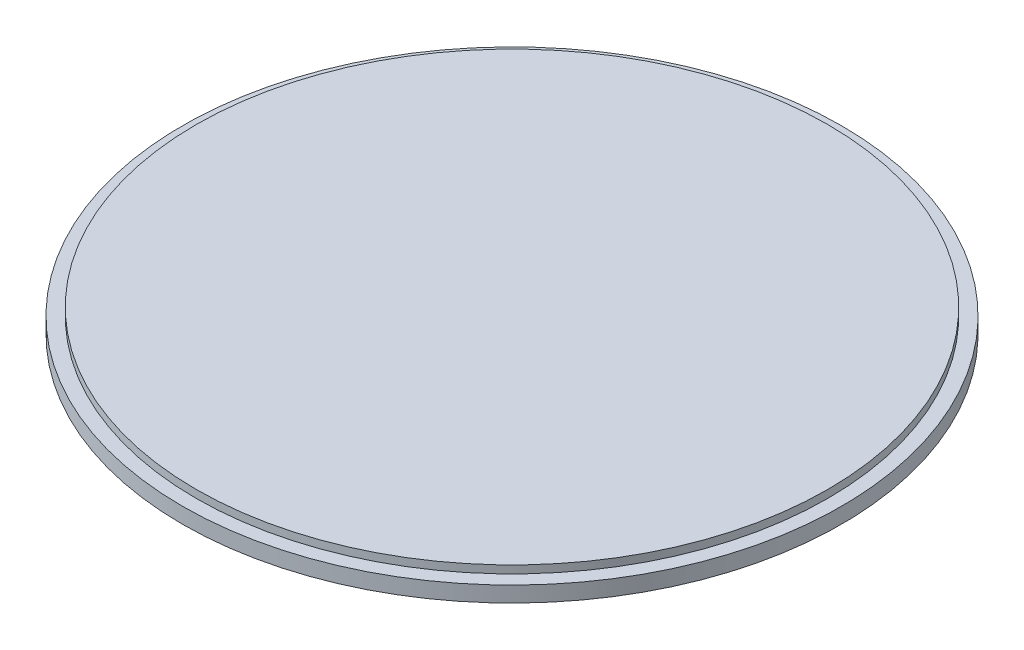
from build123d import *

# Parameters (mm, degrees)
SKETCH1_R           = 16.9
BOSS_EXTRUDE1_DEPTH = 0.8
SKETCH2_R           = 16.2
BOSS_EXTRUDE2_DEPTH = 0.4


with BuildPart() as part:
    # Sketch1 → Boss-Extrude1 (new body)
    with BuildSketch(Plane(origin=(0, 0, 0), x_dir=(1, 0, 0), z_dir=(0, 1, 0))):
        with Locations(Location((0, 0, 0), (0, 0, 270))):
            Circle(SKETCH1_R)
    extrude(amount=BOSS_EXTRUDE1_DEPTH)

    # Sketch2 → Boss-Extrude2 (add)
    with BuildSketch(Plane(origin=(0, 0.8, 0), x_dir=(1, 0, 0), z_dir=(0, 1, 0))):
        with Locations(Location((0, 0, 0), (0, 0, 270))):
            Circle(SKETCH2_R)
    extrude(amount=BOSS_EXTRUDE2_DEPTH)


solid = part.part
